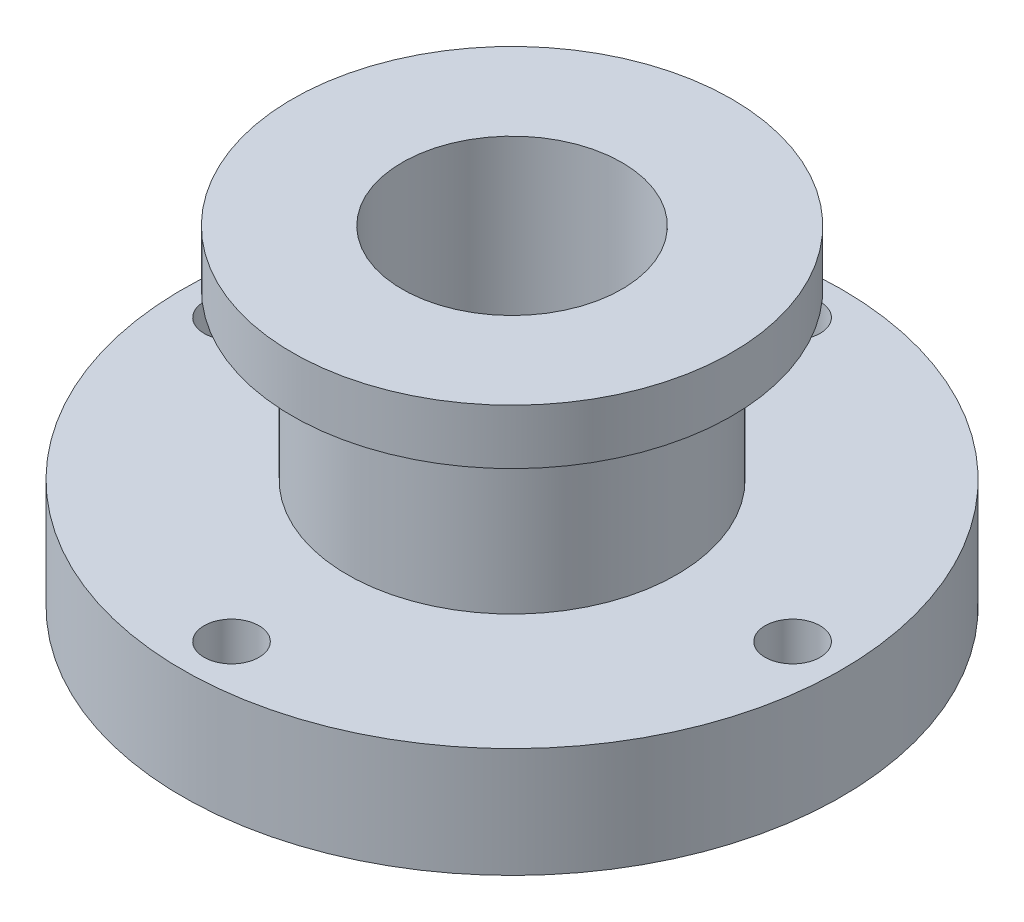
from build123d import *

# Parameters (mm, degrees)
SKETCH5_R          = 25
CUT_EXTRUDE2_DEPTH = 100


with BuildPart() as part:
    # Sketch4 → Revolve2 (revolve)
    with BuildSketch(Plane.XY):
        Polygon((0, -251.612903226), (0, -151.612903226), (100, -151.612903226), (100, 48.387096774), (152.822580645, 48.387096774), (200, 48.387096774), (200, -1.612903226), (150, -1.612903226), (150, -151.612903226), (300, -151.612903226), (300, -251.612903226), align=None)
    revolve(axis=Axis((0, -251.612903226, 0), (0, 1, 0)))

    # Sketch5 → Cut-Extrude2 (cut)
    with BuildSketch(Plane(origin=(0, -151.612903226, 0), x_dir=(1, 0, 0), z_dir=(0, 1, 0))):
        with Locations((0, 255.365455535)):
            Circle(SKETCH5_R)
        with Locations((255.365455535, 0)):
            Circle(SKETCH5_R)
        with Locations((0, -255.365455535)):
            Circle(SKETCH5_R)
        with Locations((-255.365455535, 0)):
            Circle(SKETCH5_R)
    extrude(amount=-CUT_EXTRUDE2_DEPTH, mode=Mode.SUBTRACT)


solid = part.part
